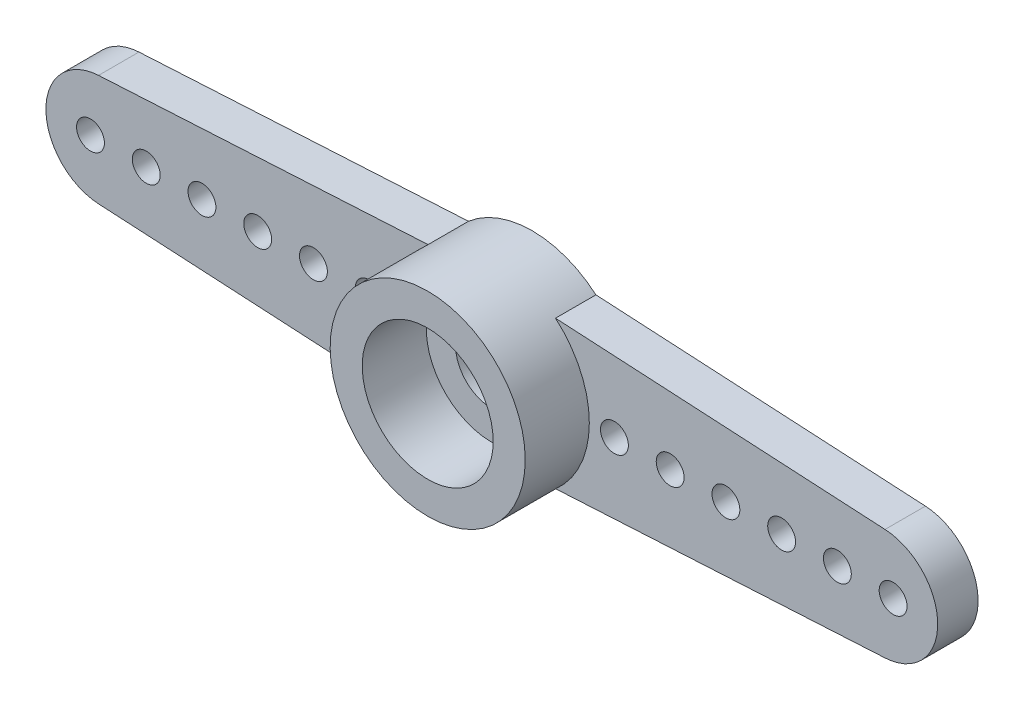
from build123d import *

# Parameters (mm, degrees)
SKETCH_1_R               = 2.772053215
SKETCH_1_R_2             = 2
SKETCH_1_R_3             = 3.5
EXTRUDE_1_DEPTH          = 1.45
SKETCH_2_R               = 3.5
SKETCH_2_R_2             = 2.35
EXTRUDE_2_DEPTH          = 2.3
SKETCH_3_R               = 2.3
CUT_EXTRUDE_1_DEPTH      = 0.7
SKETCH_4_R               = 1.3
CUT_EXTRUDE_2_DEPTH      = 17.659906963
SKETCH_5_R               = 0.5
CUT_EXTRUDE_3_DEPTH      = 17.8021576
PATTERN_LINEAR_1_COUNT   = 6
PATTERN_LINEAR_1_PITCH   = 2
MIRROR_1_COPY_1_SKETCH_R = 0.5
MIRROR_1_COPY_1_DEPTH    = 17.8021576
MIRROR_1_COPY_2_SKETCH_R = 0.5
MIRROR_1_COPY_2_DEPTH    = 17.8021576
MIRROR_1_COPY_3_SKETCH_R = 0.5
MIRROR_1_COPY_3_DEPTH    = 17.8021576
MIRROR_1_COPY_4_SKETCH_R = 0.5
MIRROR_1_COPY_4_DEPTH    = 17.8021576
MIRROR_1_COPY_5_SKETCH_R = 0.5
MIRROR_1_COPY_5_DEPTH    = 17.8021576


with BuildPart() as part:
    # 草图1 → 凸台-拉伸1 (new body)
    with BuildSketch(Plane.XY):
        with BuildLine():
            Line((0.152869496, 2.767834884), (-1.980633731, 2.885669771))
            ThreePointArc((-1.980633731, 2.885669771), (-3.5, 0), (-1.980633731, -2.885669771))
            Line((-1.980633731, -2.885669771), (0.152869466, -2.767834886))
            ThreePointArc((0.152869466, -2.767834886), (-2.772053215, 1.5e-08), (0.152869496, 2.767834884))
        make_face()
        with BuildLine():
            Line((2.286372673, 2.65), (0.152869496, 2.767834884))
            ThreePointArc((0.152869496, 2.767834884), (2.013459884, 1.90532368), (2.772053215, 0))
            ThreePointArc((2.772053215, 0), (2.013459873, -1.905323691), (0.152869466, -2.767834886))
            Line((0.152869466, -2.767834886), (2.286372673, -2.65))
            ThreePointArc((2.286372673, -2.65), (3.182161557, -1.457342726), (3.5, 0))
            ThreePointArc((3.5, 0), (3.182161557, 1.457342726), (2.286372673, 2.65))
        make_face()
        Circle(SKETCH_1_R)
        with BuildLine():
            ThreePointArc((2.286372673, 2.65), (0.193013304, 3.494673928), (-1.980633731, 2.885669771))
            Line((-1.980633731, 2.885669771), (0.152869496, 2.767834884))
            Line((0.152869496, 2.767834884), (2.286372673, 2.65))
        make_face()
        with BuildLine():
            Line((0.152869466, -2.767834886), (-1.980633731, -2.885669771))
            ThreePointArc((-1.980633731, -2.885669771), (0.193013304, -3.494673928), (2.286372673, -2.65))
            Line((2.286372673, -2.65), (0.152869466, -2.767834886))
        make_face()
        with BuildLine():
            Line((14.11029331, 1.996956531), (2.286372673, 2.65))
            ThreePointArc((2.286372673, 2.65), (3.182161557, 1.457342726), (3.5, 0))
            ThreePointArc((3.5, 0), (3.182161557, -1.457342726), (2.286372673, -2.65))
            Line((2.286372673, -2.65), (14.110293326, -1.99695653))
            ThreePointArc((14.110293326, -1.99695653), (12, -8e-09), (14.11029331, 1.996956531))
        make_face()
        with Locations((14, 0)):
            Circle(SKETCH_1_R_2)
        Circle(SKETCH_1_R_3)
    extrude_1 = extrude(amount=EXTRUDE_1_DEPTH)

    # 草图2 → 凸台-拉伸2 (add)
    with BuildSketch(Plane.XY.offset(1.45)):
        with Locations(Location((0, 0, 0), (0, 0, 310.787038193))):
            Circle(SKETCH_2_R)
        Circle(SKETCH_2_R_2, mode=Mode.SUBTRACT)
    extrude(amount=EXTRUDE_2_DEPTH)

    # 草图3 → 切除-拉伸1 (cut)
    with BuildSketch(Plane(origin=(0, 0, 0), x_dir=(-1, 0, 0), z_dir=(0, 0, -1))):
        Circle(SKETCH_3_R)
    cut_extrude_1 = extrude(amount=-CUT_EXTRUDE_1_DEPTH, mode=Mode.SUBTRACT)

    # 草图4 → 切除-拉伸2 (cut, through all)
    with BuildSketch(Plane(origin=(0, 0, 0.7), x_dir=(-1, 0, 0), z_dir=(0, 0, -1))):
        Circle(SKETCH_4_R)
    cut_extrude_2 = extrude(amount=-CUT_EXTRUDE_2_DEPTH, mode=Mode.SUBTRACT)

    # 草图5 → 切除-拉伸3 (cut, through all)
    with BuildSketch(Plane(origin=(0, 0, 0), x_dir=(-1, 0, 0), z_dir=(0, 0, -1))):
        with Locations((-14.4, 0)):
            Circle(SKETCH_5_R)
    cut_extrude_3 = extrude(amount=-CUT_EXTRUDE_3_DEPTH, mode=Mode.SUBTRACT)

    # 阵列(线性)1: 切除-拉伸3 ×6
    with Locations(*[(-i * PATTERN_LINEAR_1_PITCH, 0, 0) for i in range(1, PATTERN_LINEAR_1_COUNT)]):
        add(cut_extrude_3, mode=Mode.SUBTRACT)

    # 镜向1: 凸台-拉伸1, 切除-拉伸1, 切除-拉伸2, 切除-拉伸3 across plane
    add(extrude_1.mirror(Plane(origin=(0, 0, 0), x_dir=(0, 0, 1), z_dir=(1, 0, 0))))
    add(cut_extrude_1.mirror(Plane(origin=(0, 0, 0), x_dir=(0, 0, 1), z_dir=(1, 0, 0))), mode=Mode.SUBTRACT)
    add(cut_extrude_2.mirror(Plane(origin=(0, 0, 0), x_dir=(0, 0, 1), z_dir=(1, 0, 0))), mode=Mode.SUBTRACT)
    add(cut_extrude_3.mirror(Plane(origin=(0, 0, 0), x_dir=(0, 0, 1), z_dir=(1, 0, 0))), mode=Mode.SUBTRACT)

    # 镜向1 copy 1 sketch → 镜向1 copy 1 (cut, through all)
    with BuildSketch(Plane(origin=(2, 0, 0), x_dir=(1, 0, 0), z_dir=(0, 0, -1))):
        with Locations((-14.4, 0)):
            Circle(MIRROR_1_COPY_1_SKETCH_R)
    extrude(amount=-MIRROR_1_COPY_1_DEPTH, mode=Mode.SUBTRACT)

    # 镜向1 copy 2 sketch → 镜向1 copy 2 (cut, through all)
    with BuildSketch(Plane(origin=(4, 0, 0), x_dir=(1, 0, 0), z_dir=(0, 0, -1))):
        with Locations((-14.4, 0)):
            Circle(MIRROR_1_COPY_2_SKETCH_R)
    extrude(amount=-MIRROR_1_COPY_2_DEPTH, mode=Mode.SUBTRACT)

    # 镜向1 copy 3 sketch → 镜向1 copy 3 (cut, through all)
    with BuildSketch(Plane(origin=(6, 0, 0), x_dir=(1, 0, 0), z_dir=(0, 0, -1))):
        with Locations((-14.4, 0)):
            Circle(MIRROR_1_COPY_3_SKETCH_R)
    extrude(amount=-MIRROR_1_COPY_3_DEPTH, mode=Mode.SUBTRACT)

    # 镜向1 copy 4 sketch → 镜向1 copy 4 (cut, through all)
    with BuildSketch(Plane(origin=(8, 0, 0), x_dir=(1, 0, 0), z_dir=(0, 0, -1))):
        with Locations((-14.4, 0)):
            Circle(MIRROR_1_COPY_4_SKETCH_R)
    extrude(amount=-MIRROR_1_COPY_4_DEPTH, mode=Mode.SUBTRACT)

    # 镜向1 copy 5 sketch → 镜向1 copy 5 (cut, through all)
    with BuildSketch(Plane(origin=(10, 0, 0), x_dir=(1, 0, 0), z_dir=(0, 0, -1))):
        with Locations((-14.4, 0)):
            Circle(MIRROR_1_COPY_5_SKETCH_R)
    extrude(amount=-MIRROR_1_COPY_5_DEPTH, mode=Mode.SUBTRACT)


solid = part.part
